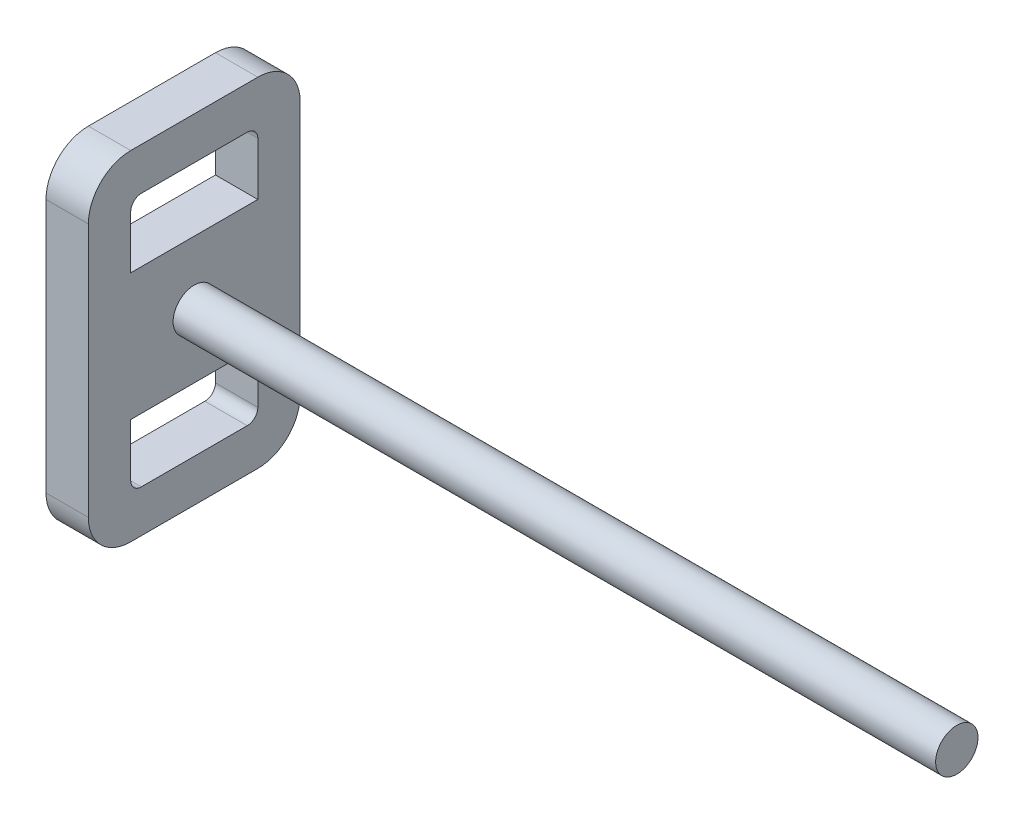
from build123d import *

# Parameters (mm, degrees)
SKETCH1_R           = 12.7
BOSS_EXTRUDE1_DEPTH = 457.2
SKETCH2_R           = 3.175
BOSS_EXTRUDE2_DEPTH = 25.4
CUT_EXTRUDE1_START  = -50.8
SKETCH3_R           = 3.175
CUT_EXTRUDE1_DEPTH  = 50.8


with BuildPart() as part:
    # Sketch1 → Boss-Extrude1 (new body)
    with BuildSketch(Plane(origin=(0, 0, 0), x_dir=(0, 0, -1), z_dir=(1, 0, 0))):
        Circle(SKETCH1_R)
    extrude(amount=BOSS_EXTRUDE1_DEPTH)

    # Sketch2 → Boss-Extrude2 (add)
    with BuildSketch(Plane.ZY):
        with BuildLine():
            Line((-38.1, -101.6), (38.1, -101.6))
            ThreePointArc((38.1, -101.6), (56.060512242, -94.160512242), (63.5, -76.2))
            Line((63.5, -76.2), (63.5, 76.2))
            ThreePointArc((63.5, 76.2), (56.060512242, 94.160512242), (38.1, 101.6))
            Line((38.1, 101.6), (-38.1, 101.6))
            ThreePointArc((-38.1, 101.6), (-56.060512242, 94.160512242), (-63.5, 76.2))
            Line((-63.5, 76.2), (-63.5, -76.2))
            ThreePointArc((-63.5, -76.2), (-56.060512242, -94.160512242), (-38.1, -101.6))
        make_face()
        Circle(SKETCH2_R, mode=Mode.SUBTRACT)
        with BuildLine():
            Line((31.75, 76.2), (-31.75, 76.2))
            ThreePointArc((-31.75, 76.2), (-36.240128061, 74.340128061), (-38.1, 69.85))
            Line((-38.1, 69.85), (-38.1, 38.1))
            Line((-38.1, 38.1), (38.1, 38.1))
            Line((38.1, 38.1), (38.1, 69.85))
            ThreePointArc((38.1, 69.85), (36.240128061, 74.340128061), (31.75, 76.2))
        make_face(mode=Mode.SUBTRACT)
        with BuildLine():
            Line((31.75, -76.2), (-31.75, -76.2))
            ThreePointArc((-31.75, -76.2), (-36.240128061, -74.340128061), (-38.1, -69.85))
            Line((-38.1, -69.85), (-38.1, -38.1))
            Line((-38.1, -38.1), (38.1, -38.1))
            Line((38.1, -38.1), (38.1, -69.85))
            ThreePointArc((38.1, -69.85), (36.240128061, -74.340128061), (31.75, -76.2))
        make_face(mode=Mode.SUBTRACT)
    extrude(amount=BOSS_EXTRUDE2_DEPTH)

    # Sketch3 → Cut-Extrude1 (cut)
    with BuildSketch(Plane.ZY.offset(25.4).offset(CUT_EXTRUDE1_START)):
        Circle(SKETCH3_R)
    extrude(amount=CUT_EXTRUDE1_DEPTH, mode=Mode.SUBTRACT)


solid = part.part
